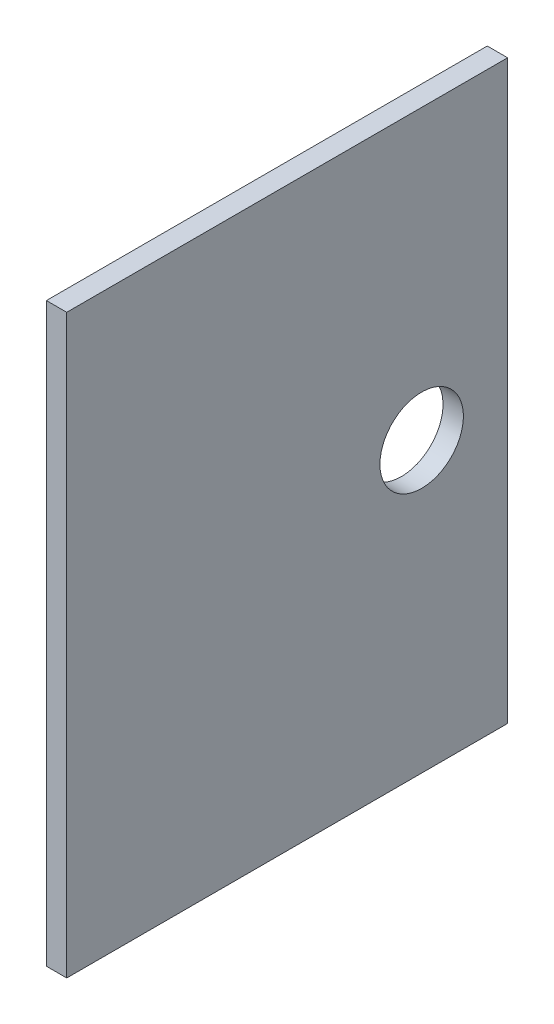
from build123d import *

# Parameters (mm, degrees)
SKETCH1_W           = 165.1
SKETCH1_H           = 215.9
SKETCH1_R           = 15.621
BOSS_EXTRUDE1_DEPTH = 7.62


with BuildPart() as part:
    # Sketch1 → Boss-Extrude1 (new body)
    with BuildSketch(Plane(origin=(0, 0, 0), x_dir=(0, 0, -1), z_dir=(1, 0, 0))):
        Rectangle(SKETCH1_W, SKETCH1_H)
        with Locations(Location((50.361129664, 0, 0), (0, 0, 180))):
            Circle(SKETCH1_R, mode=Mode.SUBTRACT)
    extrude(amount=BOSS_EXTRUDE1_DEPTH)


solid = part.part
